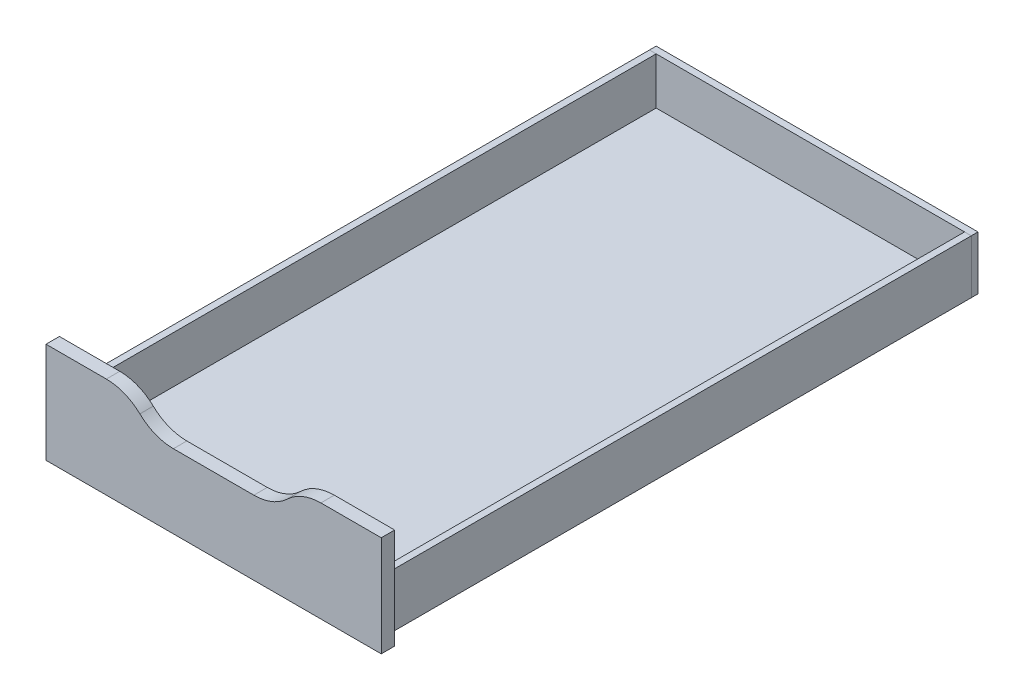
from build123d import *

# Parameters (mm, degrees)
SKETCH1_W           = 292.1
SKETCH1_H           = 552.45
BOSS_EXTRUDE1_DEPTH = 6.35
SKETCH2_W           = 317.5
SKETCH2_H           = 95.25
BOSS_EXTRUDE2_DEPTH = 12.7
CUT_EXTRUDE1_DEPTH  = 594.716510634
SKETCH4_W           = 552.45
SKETCH4_H           = 50.8
BOSS_EXTRUDE3_DEPTH = 6.35
SKETCH5_W           = 304.8
SKETCH5_H           = 50.8
BOSS_EXTRUDE4_DEPTH = 6.35


with BuildPart() as part:
    # Sketch1 → Boss-Extrude1 (new body)
    with BuildSketch(Plane(origin=(0, 0, 0), x_dir=(1, 0, 0), z_dir=(0, 1, 0))):
        with Locations((0, -3.175)):
            Rectangle(SKETCH1_W, SKETCH1_H)
    extrude(amount=BOSS_EXTRUDE1_DEPTH)


with BuildPart() as body_2:
    # Sketch2 → Boss-Extrude2 (new body)
    with BuildSketch(Plane.XY.offset(279.4)):
        with Locations((0, 41.275)):
            Rectangle(SKETCH2_W, SKETCH2_H)
    extrude(amount=BOSS_EXTRUDE2_DEPTH)

    # Sketch3 → Cut-Extrude1 (cut, through all)
    with BuildSketch(Plane.XY.offset(292.1)):
        with BuildLine():
            Line((-101.6, 101.6), (101.6, 101.6))
            Line((101.6, 101.6), (101.6, 88.9))
            ThreePointArc((101.6, 88.9), (84.502101737, 85.607245657), (69.85, 76.2))
            ThreePointArc((69.85, 76.2), (55.197898263, 66.792754343), (38.1, 63.5))
            Line((38.1, 63.5), (-38.1, 63.5))
            ThreePointArc((-38.1, 63.5), (-55.197898263, 66.792754343), (-69.85, 76.2))
            ThreePointArc((-69.85, 76.2), (-84.502101737, 85.607245657), (-101.6, 88.9))
            Line((-101.6, 88.9), (-101.6, 101.6))
        make_face()
    extrude(amount=-CUT_EXTRUDE1_DEPTH, mode=Mode.SUBTRACT)


with BuildPart() as body_3:
    # Sketch4 → Boss-Extrude3 (new body)
    with BuildSketch(Plane(origin=(146.05, 0, 0), x_dir=(0, 0, -1), z_dir=(1, 0, 0))):
        with Locations((-3.175, 25.4)):
            Rectangle(SKETCH4_W, SKETCH4_H)
    extrude(amount=BOSS_EXTRUDE3_DEPTH)


with BuildPart() as body_4:
    # Mirror2: mirrored copy
    add(body_3.part.mirror(Plane(origin=(0, 0, 0), x_dir=(0, 0, 1), z_dir=(1, 0, 0))))


with BuildPart() as body_5:
    # Sketch5 → Boss-Extrude4 (new body)
    with BuildSketch(Plane(origin=(0, 0, -273.05), x_dir=(-1, 0, 0), z_dir=(0, 0, -1))):
        with Locations((0, 25.4)):
            Rectangle(SKETCH5_W, SKETCH5_H)
    extrude(amount=BOSS_EXTRUDE4_DEPTH)


solid = Compound([part.part, body_2.part, body_3.part, body_4.part, body_5.part])
